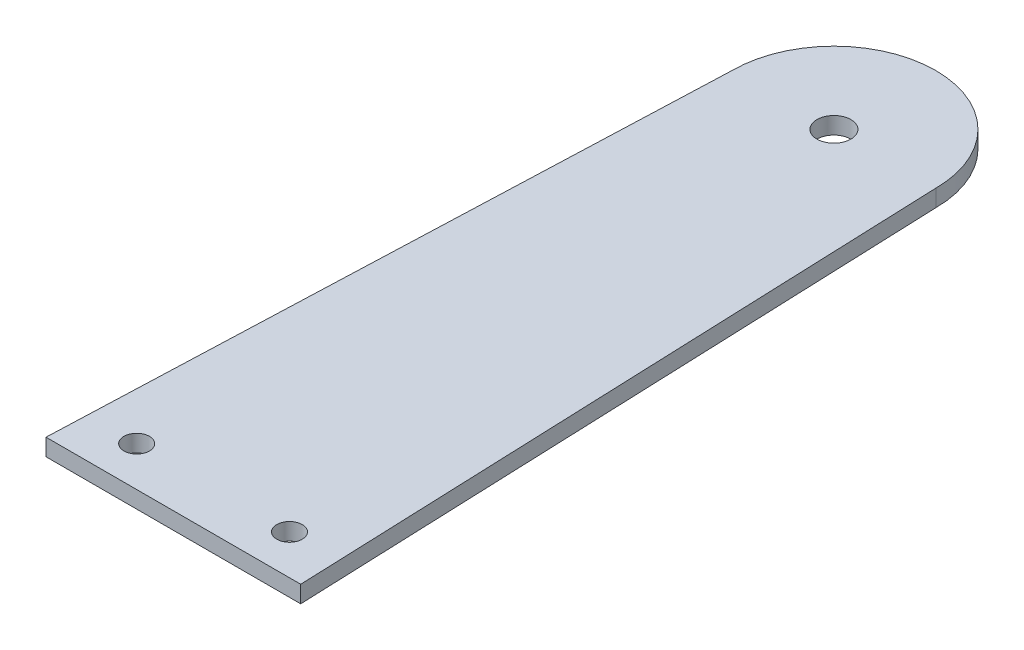
from build123d import *

# Parameters (mm, degrees)
SKETCH_1_R      = 1.5
SKETCH_1_R_2    = 2
EXTRUDE_1_DEPTH = 2


with BuildPart() as part:
    # Эскиз1 → Бобышка-Вытянуть1 (new body)
    with BuildSketch(Plane(origin=(0, 0, 0), x_dir=(1, 0, 0), z_dir=(0, 1, 0))):
        with BuildLine():
            Line((-17.625227915, -29.617278809), (12.374772085, -29.617278809))
            Line((12.374772085, -29.617278809), (9.374772085, 48.182721191))
            ThreePointArc((9.374772085, 48.182721191), (-2.625227915, 60.182721191), (-14.625227915, 48.182721191))
            Line((-14.625227915, 48.182721191), (-17.625227915, -29.617278809))
        make_face()
        with Locations(Location((-11.625227915, -24.937945637, 0), (0, 0, 270))):
            Circle(SKETCH_1_R, mode=Mode.SUBTRACT)
        with Locations(Location((6.374772085, -24.937945637, 0), (0, 0, 270))):
            Circle(SKETCH_1_R, mode=Mode.SUBTRACT)
        with Locations(Location((-2.625227915, 48.182721191, 0), (0, 0, 270))):
            Circle(SKETCH_1_R_2, mode=Mode.SUBTRACT)
    extrude(amount=EXTRUDE_1_DEPTH)


solid = part.part
